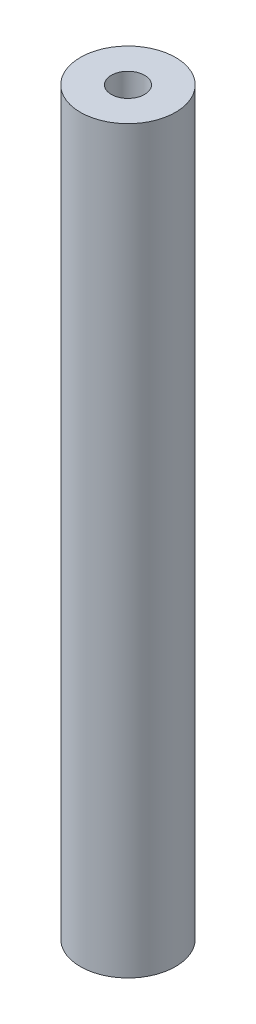
from build123d import *

# Parameters (mm, degrees)
SKETCH1_R           = 4
SKETCH1_R_2         = 1.4
BOSS_EXTRUDE1_DEPTH = 62.2


with BuildPart() as part:
    # Sketch1 → Boss-Extrude1 (new body)
    with BuildSketch(Plane(origin=(0, 0, 0), x_dir=(1, 0, 0), z_dir=(0, 1, 0))):
        with Locations(Location((0, 0, 0), (0, 0, 270))):
            Circle(SKETCH1_R)
        with Locations(Location((0, 0, 0), (0, 0, 270))):
            Circle(SKETCH1_R_2, mode=Mode.SUBTRACT)
    extrude(amount=BOSS_EXTRUDE1_DEPTH)


solid = part.part
